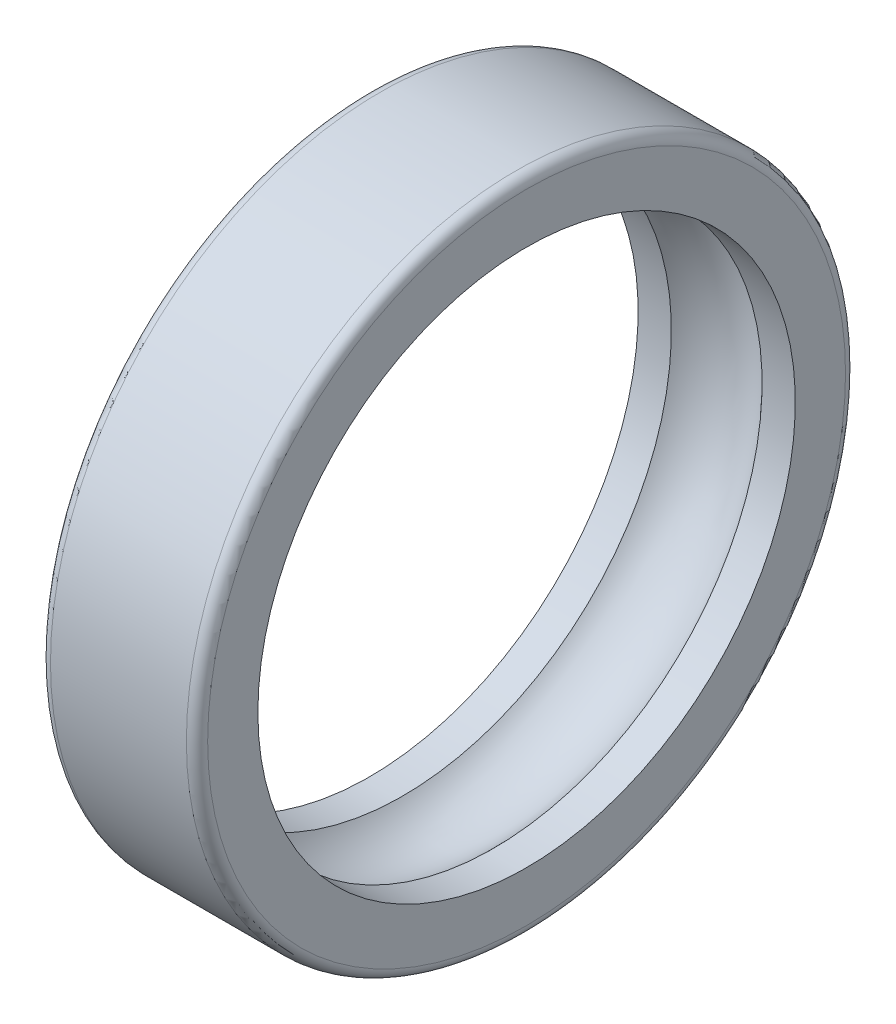
from build123d import *

# Parameters (mm, degrees)
FILLET2_R = 21


with BuildPart() as part:
    # Sketch1 → Revolve1 (revolve)
    with BuildSketch(Plane.XY, mode=Mode.PRIVATE) as revolve1_sk:
        with BuildLine():
            Line((155, 530), (89.4427191, 530))
            ThreePointArc((89.4427191, 530), (0, 570), (-89.4427191, 530))
            Line((-89.4427191, 530), (-155, 530))
            Line((-155, 530), (-155, 650))
            Line((-155, 650), (155, 650))
            Line((155, 650), (155, 530))
        make_face()
    revolve(revolve1_sk.sketch.rotate(Axis((-124.426605505, 0, 0), (1, 0, 0)), 90), axis=Axis((-124.426605505, 0, 0), (1, 0, 0)))

    # Fillet2
    fillet2_edges = [part.edges().sort_by_distance(p)[0] for p in [
        (155, 0, -650),
        (-155, 0, -650),
    ]]
    fillet(fillet2_edges, radius=FILLET2_R)


solid = part.part
